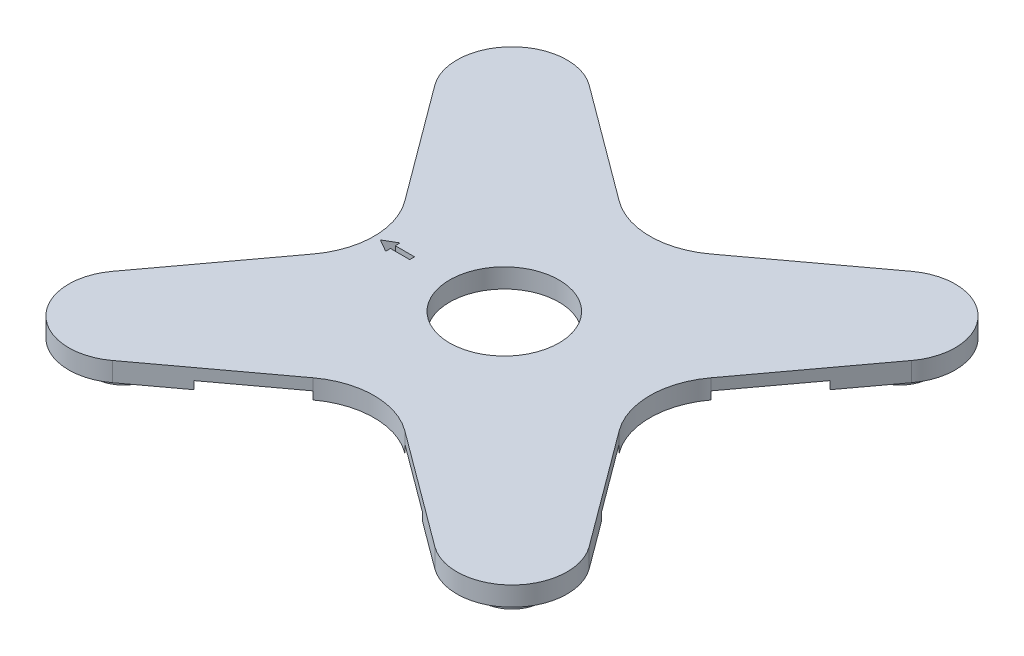
from build123d import *

# Parameters (mm, degrees)
SKETCH1_R           = 5
SKETCH1_R_2         = 9.017
BOSS_EXTRUDE1_DEPTH = 3.175
BOSS_EXTRUDE2_START = -3.175
SKETCH1_3_R         = 5
BOSS_EXTRUDE2_DEPTH = 6.35
CUT_EXTRUDE1_DEPTH  = 1.3


with BuildPart() as part:
    # Sketch1 → Boss-Extrude1 (new body)
    with BuildSketch(Plane(origin=(0, 0, 0), x_dir=(1, 0, 0), z_dir=(0, 1, 0))):
        with BuildLine():
            Line((-39.315149004, 26.587226943), (-25.231781425, 7.554111896))
            ThreePointArc((-25.231781425, 7.554111896), (-22.740865295, 0), (-25.231781425, -7.554111896))
            Line((-25.231781425, -7.554111896), (-39.315149004, -26.587226943))
            ThreePointArc((-39.315149004, -26.587226943), (-38.434652948, -38.434652948), (-26.587226943, -39.315149004))
            Line((-26.587226943, -39.315149004), (-7.554111896, -25.231781425))
            ThreePointArc((-7.554111896, -25.231781425), (0, -22.740865295), (7.554111896, -25.231781425))
            Line((7.554111896, -25.231781425), (26.587226943, -39.315149004))
            ThreePointArc((26.587226943, -39.315149004), (38.434652948, -38.434652948), (39.315149004, -26.587226943))
            Line((39.315149004, -26.587226943), (25.231781425, -7.554111896))
            ThreePointArc((25.231781425, -7.554111896), (22.740865295, 0), (25.231781425, 7.554111896))
            Line((25.231781425, 7.554111896), (39.315149004, 26.587226943))
            ThreePointArc((39.315149004, 26.587226943), (38.434652948, 38.434652948), (26.587226943, 39.315149004))
            Line((26.587226943, 39.315149004), (7.554111896, 25.231781425))
            ThreePointArc((7.554111896, 25.231781425), (0, 22.740865295), (-7.554111896, 25.231781425))
            Line((-7.554111896, 25.231781425), (-26.587226943, 39.315149004))
            ThreePointArc((-26.587226943, 39.315149004), (-38.434652948, 38.434652948), (-39.315149004, 26.587226943))
        make_face()
        with Locations(Location((-32, -32, 0), (0, 0, 270))):
            Circle(SKETCH1_R, mode=Mode.SUBTRACT)
        with Locations(Location((32, -32, 0), (0, 0, 270))):
            Circle(SKETCH1_R, mode=Mode.SUBTRACT)
        Polygon((-19.642190111, 1.190625), (-19.642190111, 0.396875), (-16.467190111, 0.396875), (-16.467190111, -0.396875), (-19.642190111, -0.396875), (-19.642190111, -1.190625), (-21.704413103, 0), align=None, mode=Mode.SUBTRACT)
        with Locations(Location((-1.27, 0, 0), (0, 0, 270))):
            Circle(SKETCH1_R_2, mode=Mode.SUBTRACT)
        with Locations(Location((-32, 32, 0), (0, 0, 270))):
            Circle(SKETCH1_R, mode=Mode.SUBTRACT)
        with Locations(Location((32, 32, 0), (0, 0, 270))):
            Circle(SKETCH1_R, mode=Mode.SUBTRACT)
    extrude(amount=BOSS_EXTRUDE1_DEPTH)

    # Sketch1<3> → Boss-Extrude2 (add)
    with BuildSketch(Plane(origin=(0, 0, 0), x_dir=(1, 0, 0), z_dir=(0, 1, 0)).offset(BOSS_EXTRUDE2_START)):
        with Locations(Location((-32, 32, 0), (0, 0, 270))):
            Circle(SKETCH1_3_R)
        with Locations(Location((32, -32, 0), (0, 0, 270))):
            Circle(SKETCH1_3_R)
        with Locations(Location((32, 32, 0), (0, 0, 270))):
            Circle(SKETCH1_3_R)
        with Locations(Location((-32, -32, 0), (0, 0, 270))):
            Circle(SKETCH1_3_R)
    extrude(amount=BOSS_EXTRUDE2_DEPTH)

    # Sketch2 → Cut-Extrude1 (cut)
    with BuildSketch(Plane.XZ):
        Polygon((-6.462290551, -24.423898886), (-24.423898886, -6.462290551), (-33.589527929, -18.849276199), (-18.849276199, -33.589527929), align=None)
        Polygon((-33.589527929, 18.849276199), (-18.849276199, 33.589527929), (-6.462290551, 24.423898886), (-24.423898886, 6.462290551), align=None)
        Polygon((24.423898886, 6.462290551), (33.589527929, 18.849276199), (18.849276199, 33.589527929), (6.462290551, 24.423898886), align=None)
        Polygon((33.589527929, -18.849276199), (18.849276199, -33.589527929), (6.462290551, -24.423898886), (24.423898886, -6.462290551), align=None)
    extrude(amount=-CUT_EXTRUDE1_DEPTH, mode=Mode.SUBTRACT)


solid = part.part
